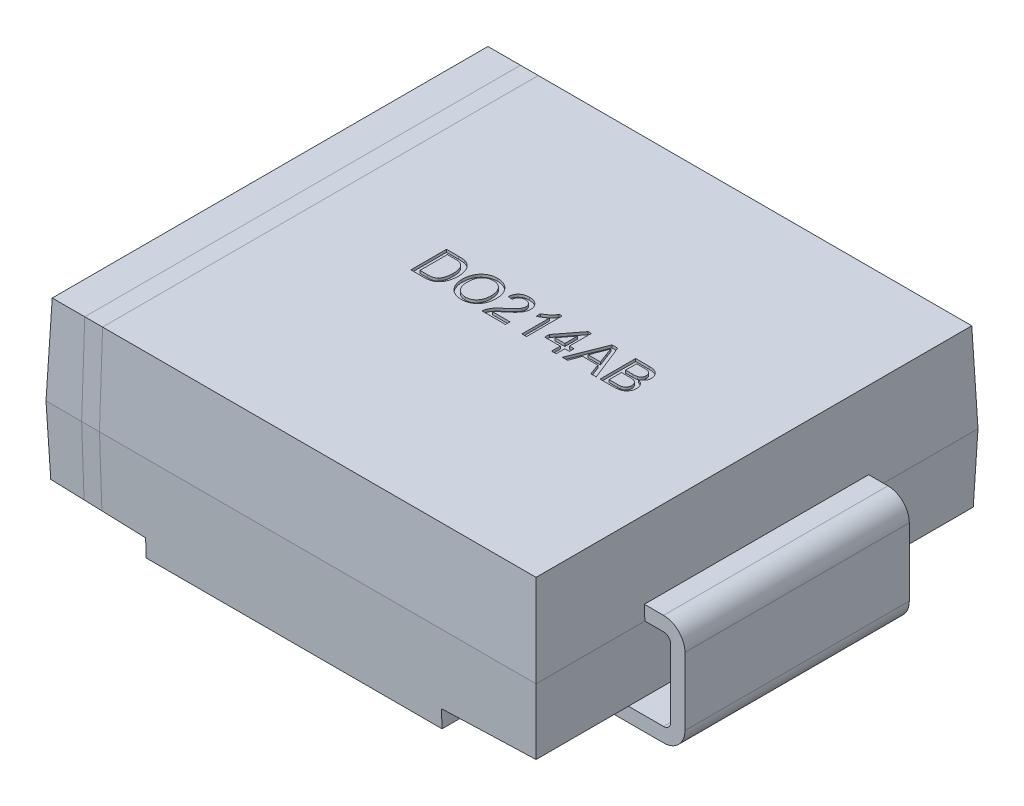
from build123d import *

# Parameters (mm, degrees)
SKETCH1_W                      = 6.985
SKETCH1_H                      = 6.2992
EXTRUDE1_DEPTH                 = 1.27
EXTRUDE1_TAPER                 = 2
EXTRUDE1_OTHER_WAY_DEPTH       = 1.27
EXTRUDE1_OTHER_WAY_TAPER       = 2
CUT_EXTRUDE1_REACH             = 6.871
CUT_EXTRUDE1_DIRECTION_2_REACH = 6.871
EXTRUDE2_DEPTH                 = 1.59893
CUT_EXTRUDE2_DEPTH             = 0.0381


with BuildPart() as part:
    # Sketch1 → Extrude1 (new body)
    with BuildSketch(Plane(origin=(0, 0, 0), x_dir=(1, 0, 0), z_dir=(0, 1, 0))):
        Rectangle(SKETCH1_W, SKETCH1_H)
    extrude(amount=EXTRUDE1_DEPTH, taper=EXTRUDE1_TAPER)

    # Sketch1 → Extrude1 other way (add)
    with BuildSketch(Plane(origin=(0, 0, 0), x_dir=(1, 0, 0), z_dir=(0, 1, 0))):
        Rectangle(SKETCH1_W, SKETCH1_H)
    extrude(amount=-EXTRUDE1_OTHER_WAY_DEPTH, taper=EXTRUDE1_OTHER_WAY_TAPER)

    # Cut-Extrude1: up to this plane
    cut_extrude1_end = Plane(origin=(-3.4925, 0, 3.1496), z_dir=(0, -0.03489949670250105, 0.9993908270190958))
    # Sketch2 → Cut-Extrude1 (cut, up to the surface)
    with BuildSketch(Plane.XY, mode=Mode.PRIVATE) as cut_extrude1_sk1:
        Polygon((2.1082, -1.016), (2.1082, -1.27), (3.448150623, -1.27), (3.458667339, -0.968840641), align=None)
    cut_extrude1_tool1 = split(extrude(cut_extrude1_sk1.sketch, amount=CUT_EXTRUDE1_REACH, mode=Mode.PRIVATE), bisect_by=cut_extrude1_end, keep=Keep.BOTH, mode=Mode.PRIVATE)
    add(cut_extrude1_tool1.solids().sort_by_distance((2.799785, -1.130712, 0))[0], mode=Mode.SUBTRACT)
    # Sketch2 → Cut-Extrude1 (cut, up to the surface)
    with BuildSketch(Plane.XY, mode=Mode.PRIVATE) as cut_extrude1_sk2:
        Polygon((-2.1082, -1.016), (-2.1082, -1.27), (-3.448150623, -1.27), (-3.458667339, -0.968840641), align=None)
    cut_extrude1_tool2 = split(extrude(cut_extrude1_sk2.sketch, amount=CUT_EXTRUDE1_REACH, mode=Mode.PRIVATE), bisect_by=cut_extrude1_end, keep=Keep.BOTH, mode=Mode.PRIVATE)
    add(cut_extrude1_tool2.solids().sort_by_distance((-2.799785, -1.130712, 0))[0], mode=Mode.SUBTRACT)

    # Cut-Extrude1 direction 2: up to this plane
    cut_extrude1_direction_2_end = Plane(origin=(-3.4925, 0, -3.1496), z_dir=(0, -0.034899496702501046, -0.9993908270190958))
    # Sketch2 → Cut-Extrude1 direction 2 (cut, up to the surface)
    with BuildSketch(Plane.XY, mode=Mode.PRIVATE) as cut_extrude1_direction_2_sk1:
        Polygon((2.1082, -1.016), (2.1082, -1.27), (3.448150623, -1.27), (3.458667339, -0.968840641), align=None)
    cut_extrude1_direction_2_tool1 = split(extrude(cut_extrude1_direction_2_sk1.sketch, amount=-CUT_EXTRUDE1_DIRECTION_2_REACH, mode=Mode.PRIVATE), bisect_by=cut_extrude1_direction_2_end, keep=Keep.BOTH, mode=Mode.PRIVATE)
    add(cut_extrude1_direction_2_tool1.solids().sort_by_distance((2.799785, -1.130712, 0))[0], mode=Mode.SUBTRACT)
    # Sketch2 → Cut-Extrude1 direction 2 (cut, up to the surface)
    with BuildSketch(Plane.XY, mode=Mode.PRIVATE) as cut_extrude1_direction_2_sk2:
        Polygon((-2.1082, -1.016), (-2.1082, -1.27), (-3.448150623, -1.27), (-3.458667339, -0.968840641), align=None)
    cut_extrude1_direction_2_tool2 = split(extrude(cut_extrude1_direction_2_sk2.sketch, amount=-CUT_EXTRUDE1_DIRECTION_2_REACH, mode=Mode.PRIVATE), bisect_by=cut_extrude1_direction_2_end, keep=Keep.BOTH, mode=Mode.PRIVATE)
    add(cut_extrude1_direction_2_tool2.solids().sort_by_distance((-2.799785, -1.130712, 0))[0], mode=Mode.SUBTRACT)

    # Sketch3 → Extrude2 (add, symmetric)
    with BuildSketch(Plane.XY):
        with BuildLine():
            Line((3.4854041, 0.2032), (3.7592, 0.2032))
            ThreePointArc((3.7592, 0.2032), (3.974726147, 0.113926147), (4.064, -0.1016))
            Line((4.064, -0.1016), (4.064, -1.0668))
            ThreePointArc((4.064, -1.0668), (3.974726147, -1.282326147), (3.7592, -1.3716))
            Line((3.7592, -1.3716), (2.5781, -1.3716))
            Line((2.5781, -1.3716), (2.5781, -1.1684))
            Line((2.5781, -1.1684), (3.7592, -1.1684))
            ThreePointArc((3.7592, -1.1684), (3.831042049, -1.138642049), (3.8608, -1.0668))
            Line((3.8608, -1.0668), (3.8608, -0.1016))
            ThreePointArc((3.8608, -0.1016), (3.831042049, -0.029757951), (3.7592, 0))
            Line((3.7592, 0), (3.4925, 0))
            Line((3.4925, 0), (3.4854041, 0.2032))
        make_face()
        with BuildLine():
            Line((-3.4854041, 0.2032), (-3.4925, 0))
            Line((-3.4925, 0), (-3.7592, 0))
            ThreePointArc((-3.7592, 0), (-3.831042049, -0.029757951), (-3.8608, -0.1016))
            Line((-3.8608, -0.1016), (-3.8608, -1.0668))
            ThreePointArc((-3.8608, -1.0668), (-3.831042049, -1.138642049), (-3.7592, -1.1684))
            Line((-3.7592, -1.1684), (-2.5781, -1.1684))
            Line((-2.5781, -1.1684), (-2.5781, -1.3716))
            Line((-2.5781, -1.3716), (-3.7592, -1.3716))
            ThreePointArc((-3.7592, -1.3716), (-3.974726147, -1.282326147), (-4.064, -1.0668))
            Line((-4.064, -1.0668), (-4.064, -0.1016))
            ThreePointArc((-4.064, -0.1016), (-3.974726147, 0.113926147), (-3.7592, 0.2032))
            Line((-3.7592, 0.2032), (-3.4854041, 0.2032))
        make_face()
    extrude(amount=EXTRUDE2_DEPTH, both=True)

    # Sketch5 → Cut-Extrude2 (cut)
    # profile 1 of 7: a face of its own
    with BuildSketch(Plane(origin=(0, 1.27, 0), x_dir=(1, 0, 0), z_dir=(0, 1, 0))):
        with BuildLine():
            Line((-1.239701999, -0.201883132), (-1.239701999, 0.306116868))
            Line((-1.239701999, 0.306116868), (-1.065992864, 0.306116868))
            add(Edge.make_bspline(
                [(-1.065992864, 0.306116868), (-1.061243888, 0.306095414), (-1.052016264, 0.306053727), (-1.038612202, 0.305788039), (-1.026061099, 0.305147202), (-1.014420787, 0.304366578), (-1.003632561, 0.303327244), (-0.993710201, 0.30216501), (-0.984645968, 0.300649027), (-0.978947184, 0.299388963), (-0.976238057, 0.298789945)],
                knots=[0, 0, 0, 0, 1.263127796, 2.454354013, 3.565393221, 4.605443485, 5.557051711, 6.447822442, 7.26211484, 8, 8, 8, 8], degree=3))
            add(Edge.make_bspline(
                [(-0.976238057, 0.298789945), (-0.969231785, 0.296951768), (-0.95546728, 0.293340489), (-0.936037234, 0.285217384), (-0.918199605, 0.275028432), (-0.907620769, 0.266635663), (-0.902358249, 0.262460618)],
                knots=[0, 0, 0, 0, 1.04477941, 2.052571232, 3.03123721, 4, 4, 4, 4], degree=3))
            add(Edge.make_bspline(
                [(-0.902358249, 0.262460618), (-0.89909078, 0.25959125), (-0.892541052, 0.253839526), (-0.88354504, 0.24436314), (-0.875199588, 0.234310235), (-0.86725543, 0.22385388), (-0.860220668, 0.212612863), (-0.853626566, 0.200910731), (-0.847874912, 0.188512489), (-0.842580601, 0.175620761), (-0.837863731, 0.162185298), (-0.833988043, 0.148214777), (-0.83042752, 0.133855083), (-0.827779317, 0.11894925), (-0.825467573, 0.103623709), (-0.824000015, 0.087790743), (-0.823047815, 0.071497617), (-0.822937469, 0.060462837), (-0.822881486, 0.054864464)],
                knots=[0, 0, 0, 0, 0.908997367, 1.822109427, 2.728529095, 3.640759027, 4.565643067, 5.499218265, 6.448003669, 7.421473682, 8.413047621, 9.423472075, 10.452328391, 11.505545429, 12.587978234, 13.692612971, 14.829372988, 16, 16, 16, 16], degree=3))
            add(Edge.make_bspline(
                [(-0.822881486, 0.054864464), (-0.823017946, 0.045495698), (-0.823283494, 0.027264299), (-0.825909664, 0.000747068), (-0.829973439, -0.024178261), (-0.835887689, -0.047362018), (-0.843171704, -0.06867562), (-0.851117933, -0.088293138), (-0.860264607, -0.105876545), (-0.870298303, -0.121574478), (-0.881049143, -0.135486258), (-0.892311923, -0.147820678), (-0.904120032, -0.158583197), (-0.916413485, -0.168056265), (-0.929830751, -0.175900226), (-0.944231069, -0.182943442), (-0.960081634, -0.188602663), (-0.977083949, -0.193552909), (-0.995437713, -0.197261514), (-1.01504354, -0.199986716), (-1.035978483, -0.20163468), (-1.050352268, -0.20179871), (-1.057750076, -0.201883132)],
                knots=[0, 0, 0, 0, 1.410753827, 2.745293735, 4.009435601, 5.211453015, 6.344066657, 7.400119332, 8.396481539, 9.324811333, 10.202671465, 11.041621015, 11.837259285, 12.606727868, 13.374311266, 14.17412185, 15.017911533, 15.905707008, 16.839601966, 17.835295848, 18.885883805, 20, 20, 20, 20], degree=3))
            Line((-1.057750076, -0.201883132), (-1.239701999, -0.201883132))
        make_face()
        with BuildLine():
            Line((-1.168060973, -0.143267747), (-1.063347031, -0.143267747))
            add(Edge.make_bspline(
                [(-1.063347031, -0.143267747), (-1.055711551, -0.143153447), (-1.041266923, -0.142937217), (-1.020887835, -0.141276575), (-1.003101588, -0.138412191), (-0.987710951, -0.134336945), (-0.974357171, -0.129067027), (-0.962599102, -0.122836724), (-0.952140153, -0.115766731), (-0.946248626, -0.110110441), (-0.943368665, -0.107345472)],
                knots=[0, 0, 0, 0, 1.423649224, 2.693227144, 3.808972214, 4.778671344, 5.656058397, 6.479437267, 7.256702014, 8, 8, 8, 8], degree=3))
            add(Edge.make_bspline(
                [(-0.943368665, -0.107345472), (-0.939620972, -0.103060267), (-0.93192192, -0.094256983), (-0.922334603, -0.078878113), (-0.913973997, -0.06157394), (-0.906985005, -0.04216025), (-0.901254212, -0.020702708), (-0.897431992, 0.002990885), (-0.894932992, 0.028759424), (-0.894662746, 0.04668306), (-0.894522512, 0.055983855)],
                knots=[0, 0, 0, 0, 0.782184731, 1.606876467, 2.483531085, 3.422528604, 4.441347086, 5.534669947, 6.720709839, 8, 8, 8, 8], degree=3))
            add(Edge.make_bspline(
                [(-0.894522512, 0.055983855), (-0.8946094, 0.062463826), (-0.894778307, 0.075060626), (-0.895831299, 0.093412052), (-0.89791006, 0.11058715), (-0.900568601, 0.126615628), (-0.904198421, 0.141446535), (-0.908349183, 0.155221969), (-0.913570985, 0.16776185), (-0.9195297, 0.179162987), (-0.92606648, 0.189501095), (-0.93287804, 0.19899823), (-0.939999237, 0.207623254), (-0.947580964, 0.215253449), (-0.955395306, 0.222114456), (-0.963587943, 0.228065808), (-0.972135949, 0.233105676), (-0.978142578, 0.23572191), (-0.981122672, 0.237019913)],
                knots=[0, 0, 0, 0, 1.460126857, 2.838427476, 4.139102445, 5.35666337, 6.496721546, 7.577303074, 8.594995104, 9.55219858, 10.472533725, 11.348579167, 12.184287935, 12.989560785, 13.769667798, 14.524891986, 15.268148459, 16, 16, 16, 16], degree=3))
            add(Edge.make_bspline(
                [(-0.981122672, 0.237019913), (-0.983451199, 0.237872053), (-0.988385196, 0.239677682), (-0.996437956, 0.241721383), (-1.005424918, 0.243602154), (-1.015434664, 0.24492221), (-1.026416568, 0.24620516), (-1.038438894, 0.246984783), (-1.051438591, 0.247338087), (-1.060429648, 0.247445805), (-1.065076999, 0.247501483)],
                knots=[0, 0, 0, 0, 0.699400087, 1.48198292, 2.341906832, 3.289648813, 4.329964754, 5.462247508, 6.688271602, 8, 8, 8, 8], degree=3))
            Line((-1.065076999, 0.247501483), (-1.168060973, 0.247501483))
            Line((-1.168060973, 0.247501483), (-1.168060973, -0.143267747))
        make_face(mode=Mode.SUBTRACT)
    # profile 2 of 7: a face of its own
    with BuildSketch(Plane(origin=(0, 1.27, 0), x_dir=(1, 0, 0), z_dir=(0, 1, 0))):
        with BuildLine():
            add(Edge.make_bspline(
                [(-0.757753281, 0.045400522), (-0.75757672, 0.055585484), (-0.757232699, 0.075430366), (-0.754018329, 0.104327072), (-0.748799016, 0.131515092), (-0.741337548, 0.156992308), (-0.731880115, 0.180798644), (-0.720382798, 0.202988005), (-0.706499766, 0.223309223), (-0.69079452, 0.241955744), (-0.673252481, 0.258440635), (-0.654575195, 0.27308158), (-0.634529442, 0.285293859), (-0.613300429, 0.295377175), (-0.590797963, 0.303118853), (-0.567085224, 0.308538733), (-0.542187573, 0.312035082), (-0.525169446, 0.312428607), (-0.516473633, 0.312629689)],
                knots=[0, 0, 0, 0, 1.203621547, 2.345195544, 3.432004029, 4.472479546, 5.478447225, 6.455936844, 7.420185704, 8.381829745, 9.332027588, 10.260832629, 11.182364398, 12.100723901, 13.034044877, 13.989196293, 14.972532542, 16, 16, 16, 16], degree=3))
            add(Edge.make_bspline(
                [(-0.516473633, 0.312629689), (-0.510738148, 0.312529536), (-0.49934851, 0.312330652), (-0.482509948, 0.310817406), (-0.466104077, 0.308116525), (-0.450147054, 0.304497041), (-0.434595443, 0.299748436), (-0.419439958, 0.294142853), (-0.404813267, 0.287196745), (-0.390618063, 0.279419886), (-0.37702191, 0.270721134), (-0.36424428, 0.261111639), (-0.352315779, 0.250664079), (-0.341076174, 0.239550183), (-0.330900516, 0.227394872), (-0.321368422, 0.214568418), (-0.312753803, 0.200843388), (-0.305026092, 0.186332234), (-0.298116732, 0.171259078), (-0.292211351, 0.155561449), (-0.287140507, 0.139427651), (-0.282895784, 0.122762188), (-0.27985008, 0.105570759), (-0.277424753, 0.087927438), (-0.276148236, 0.069774563), (-0.275920087, 0.057511973), (-0.275804563, 0.051302765)],
                knots=[0, 0, 0, 0, 1.034375294, 2.054082248, 3.045783978, 4.031219655, 5.002789406, 5.976610191, 6.94273282, 7.920236376, 8.894345378, 9.851183672, 10.800797181, 11.752517031, 12.698794154, 13.65688337, 14.632873302, 15.61821402, 16.620222298, 17.621258913, 18.640965868, 19.669244166, 20.720417492, 21.788124603, 22.880008887, 24, 24, 24, 24], degree=3))
            add(Edge.make_bspline(
                [(-0.275804563, 0.051302765), (-0.275910408, 0.044991168), (-0.276119524, 0.03252152), (-0.277534486, 0.014100034), (-0.280022481, -0.003792609), (-0.283322383, -0.021209763), (-0.287744151, -0.038115167), (-0.292998743, -0.054557291), (-0.299354469, -0.070438203), (-0.306532555, -0.085796178), (-0.314654557, -0.100419991), (-0.323613676, -0.114207386), (-0.333416259, -0.127029392), (-0.343913407, -0.139043303), (-0.355350255, -0.150034288), (-0.367585974, -0.160105119), (-0.380573518, -0.169350778), (-0.394356518, -0.177520861), (-0.40868762, -0.184682231), (-0.423283234, -0.191035657), (-0.438154202, -0.196454111), (-0.453351348, -0.200845229), (-0.468833215, -0.204163474), (-0.484556237, -0.206648211), (-0.500571955, -0.208078932), (-0.511348839, -0.208289736), (-0.516778922, -0.208395953)],
                knots=[0, 0, 0, 0, 1.141429366, 2.255090526, 3.338676798, 4.407031443, 5.458968682, 6.496860253, 7.526652771, 8.550250826, 9.560787671, 10.54935636, 11.521089193, 12.477323897, 13.431786008, 14.386110112, 15.340986122, 16.312041, 17.28047646, 18.236612773, 19.189437236, 20.140779471, 21.09494583, 22.051062463, 23.018000708, 24, 24, 24, 24], degree=3))
            add(Edge.make_bspline(
                [(-0.516778922, -0.208395953), (-0.522617467, -0.208309571), (-0.534182162, -0.208138469), (-0.551275094, -0.206430589), (-0.56794278, -0.203825157), (-0.584136765, -0.200063701), (-0.59983492, -0.195156616), (-0.615055821, -0.189217236), (-0.629852999, -0.182324938), (-0.644042848, -0.174282374), (-0.65757707, -0.165339907), (-0.670324487, -0.15554199), (-0.682278049, -0.144978919), (-0.693245952, -0.1334761), (-0.703583412, -0.121450514), (-0.712877089, -0.108455178), (-0.721430501, -0.094784811), (-0.728990539, -0.080307639), (-0.735819902, -0.065453866), (-0.741573788, -0.050218743), (-0.746630338, -0.034826795), (-0.750657369, -0.019183151), (-0.753866422, -0.003323898), (-0.756024278, 0.012724574), (-0.757582698, 0.028986168), (-0.757696134, 0.039901536), (-0.757753281, 0.045400522)],
                knots=[0, 0, 0, 0, 1.072727997, 2.12480551, 3.153819198, 4.171534612, 5.177148798, 6.173931848, 7.17235114, 8.174500385, 9.168706755, 10.151274001, 11.127173509, 12.097141049, 13.070188938, 14.039134204, 15.03036519, 16.031505612, 17.038625933, 18.033164522, 19.022845559, 20.014762458, 21.000193215, 21.994692725, 22.989758729, 24, 24, 24, 24], degree=3))
        make_face()
        with BuildLine():
            add(Edge.make_bspline(
                [(-0.686112255, 0.044586419), (-0.686002469, 0.037252328), (-0.685788393, 0.022951366), (-0.683339249, 0.002101325), (-0.679623064, -0.01757175), (-0.674500696, -0.036123087), (-0.667614978, -0.053369216), (-0.659382211, -0.069475854), (-0.649525196, -0.084335935), (-0.638261407, -0.097907889), (-0.62587253, -0.110099915), (-0.612633758, -0.120749002), (-0.598542115, -0.129666858), (-0.583753832, -0.137030453), (-0.56816269, -0.14277841), (-0.551815387, -0.14681448), (-0.53469991, -0.149338715), (-0.523029266, -0.149631449), (-0.51708421, -0.149780568)],
                knots=[0, 0, 0, 0, 1.215430442, 2.370003584, 3.475209778, 4.53279855, 5.55522989, 6.548792651, 7.526809858, 8.505409025, 9.467826767, 10.404123909, 11.316848639, 12.227335424, 13.138360512, 14.065900994, 15.014765094, 16, 16, 16, 16], degree=3))
            add(Edge.make_bspline(
                [(-0.51708421, -0.149780568), (-0.511038386, -0.149629243), (-0.499200678, -0.149332949), (-0.481827163, -0.14685278), (-0.465320378, -0.142630397), (-0.449516712, -0.13700945), (-0.434701881, -0.129410887), (-0.420529407, -0.120513011), (-0.407385635, -0.109640062), (-0.394947921, -0.097426472), (-0.383792129, -0.083543485), (-0.373893713, -0.068333082), (-0.365852936, -0.051567145), (-0.35891081, -0.033615006), (-0.353827386, -0.014137362), (-0.350070424, 0.006644365), (-0.347806399, 0.028797024), (-0.347567985, 0.044004413), (-0.347445589, 0.05181158)],
                knots=[0, 0, 0, 0, 0.976878588, 1.912725521, 2.8289017, 3.727303729, 4.617335839, 5.514666588, 6.426584173, 7.368641557, 8.327632997, 9.299405846, 10.294892156, 11.327373912, 12.405931897, 13.542618837, 14.738430195, 16, 16, 16, 16], degree=3))
            add(Edge.make_bspline(
                [(-0.347445589, 0.05181158), (-0.347488844, 0.056834202), (-0.347573694, 0.06668677), (-0.348697399, 0.081209568), (-0.350146835, 0.095280623), (-0.352353624, 0.10888178), (-0.355394858, 0.121956712), (-0.35876403, 0.13460496), (-0.362977061, 0.146717528), (-0.367757332, 0.158341916), (-0.373106374, 0.169418447), (-0.379139382, 0.179853742), (-0.385786241, 0.18960723), (-0.392867609, 0.198863829), (-0.400775613, 0.207265268), (-0.409129479, 0.21516643), (-0.418118964, 0.222404075), (-0.427654355, 0.228980092), (-0.437600382, 0.234899544), (-0.447936541, 0.239965827), (-0.458498161, 0.24441592), (-0.46946203, 0.247827104), (-0.480676757, 0.250578273), (-0.492187678, 0.252668042), (-0.50403752, 0.253750222), (-0.512028101, 0.253925644), (-0.516066582, 0.254014304)],
                knots=[0, 0, 0, 0, 1.220438779, 2.394059227, 3.538503547, 4.658058814, 5.74010225, 6.800155734, 7.837851593, 8.854470756, 9.853724944, 10.825214244, 11.781044712, 12.72106398, 13.654479919, 14.581868691, 15.514082315, 16.456304431, 17.39516604, 18.324312202, 19.252140633, 20.177768678, 21.111585046, 22.057694709, 23.018348693, 24, 24, 24, 24], degree=3))
            add(Edge.make_bspline(
                [(-0.516066582, 0.254014304), (-0.521774425, 0.253900948), (-0.533036635, 0.253677285), (-0.549615948, 0.251190923), (-0.565600204, 0.247475959), (-0.581014207, 0.242282241), (-0.595726126, 0.235404941), (-0.60981218, 0.226970875), (-0.623397404, 0.217209688), (-0.636267579, 0.205883551), (-0.648265397, 0.192872584), (-0.658408349, 0.177533053), (-0.666957105, 0.160231145), (-0.67409516, 0.141010715), (-0.679537716, 0.119722914), (-0.683299203, 0.096459355), (-0.685674129, 0.071195522), (-0.68596248, 0.053682874), (-0.686112255, 0.044586419)],
                knots=[0, 0, 0, 0, 0.895090134, 1.766112571, 2.624765742, 3.468151641, 4.313618154, 5.168136083, 6.041303099, 6.935189387, 7.854749729, 8.809996334, 9.809869957, 10.877771942, 12.021723904, 13.25217762, 14.572720513, 16, 16, 16, 16], degree=3))
        make_face(mode=Mode.SUBTRACT)
    # profile 3 of 7: a face of its own
    with BuildSketch(Plane(origin=(0, 1.27, 0), x_dir=(1, 0, 0), z_dir=(0, 1, 0))):
        with BuildLine():
            Line((0.108451847, -0.136754927), (0.108451847, -0.201883132))
            Line((0.108451847, -0.201883132), (-0.223701999, -0.201883132))
            add(Edge.make_bspline(
                [(-0.223701999, -0.201883132), (-0.223708799, -0.19801238), (-0.223722376, -0.190283849), (-0.222414584, -0.178853842), (-0.22036632, -0.167575464), (-0.218050349, -0.160343089), (-0.21688389, -0.15670044)],
                knots=[0, 0, 0, 0, 1.01057331, 2.01775941, 3.001627217, 4, 4, 4, 4], degree=3))
            add(Edge.make_bspline(
                [(-0.21688389, -0.15670044), (-0.214728661, -0.150748786), (-0.210340261, -0.138630238), (-0.201449316, -0.121144867), (-0.190991464, -0.103765243), (-0.180809273, -0.089615776), (-0.171484585, -0.07831134), (-0.163664619, -0.069466928), (-0.154998662, -0.06041363), (-0.145493656, -0.051153099), (-0.13524108, -0.04162536), (-0.124226944, -0.031798637), (-0.112321189, -0.021856062), (-0.104009726, -0.01526571), (-0.099754883, -0.011891946)],
                knots=[0, 0, 0, 0, 1.204657718, 2.452881516, 3.728232997, 5.065887527, 5.768225529, 6.518857853, 7.313994055, 8.154655305, 9.046094665, 9.979688118, 10.965752482, 12, 12, 12, 12], degree=3))
            add(Edge.make_bspline(
                [(-0.099754883, -0.011891946), (-0.093218394, -0.006390289), (-0.080631968, 0.004203501), (-0.062857963, 0.019923704), (-0.046624302, 0.034520803), (-0.032189488, 0.048250642), (-0.01943546, 0.06098005), (-0.008332271, 0.072680187), (0.001215614, 0.083314539), (0.009091635, 0.093268026), (0.015736875, 0.102666886), (0.02136813, 0.111834894), (0.026061033, 0.120932194), (0.029969593, 0.12993), (0.033060933, 0.138866791), (0.03516812, 0.147768604), (0.036597142, 0.156547111), (0.036740117, 0.162388427), (0.036810822, 0.165277124)],
                knots=[0, 0, 0, 0, 1.782554561, 3.432421876, 4.950675607, 6.337395053, 7.588547463, 8.709982106, 9.702713005, 10.569305638, 11.356701089, 12.103210377, 12.812277205, 13.490692607, 14.148717897, 14.782152033, 15.397739362, 16, 16, 16, 16], degree=3))
            add(Edge.make_bspline(
                [(0.036810822, 0.165277124), (0.036740108, 0.168132117), (0.036601372, 0.173733459), (0.035285049, 0.181930986), (0.033452622, 0.189825402), (0.030490145, 0.197274587), (0.026963906, 0.204499143), (0.022440653, 0.211270782), (0.017208179, 0.21775827), (0.01121744, 0.223790564), (0.004674149, 0.229449818), (-0.002637045, 0.234154034), (-0.010235947, 0.238389229), (-0.018384711, 0.241794569), (-0.027070097, 0.244295171), (-0.036228878, 0.246109964), (-0.045859602, 0.24726064), (-0.052431894, 0.247419985), (-0.055793345, 0.247501483)],
                knots=[0, 0, 0, 0, 0.988194508, 1.938783882, 2.870742509, 3.789494954, 4.709148727, 5.651055405, 6.603531303, 7.592354411, 8.592907906, 9.593461401, 10.59787167, 11.603930315, 12.645063138, 13.723588815, 14.835711238, 16, 16, 16, 16], degree=3))
            add(Edge.make_bspline(
                [(-0.055793345, 0.247501483), (-0.059324456, 0.247420389), (-0.066235101, 0.24726168), (-0.076336612, 0.246106415), (-0.085926246, 0.244341326), (-0.094981114, 0.241642656), (-0.103490194, 0.238242995), (-0.111418832, 0.233963727), (-0.118893997, 0.229133207), (-0.125680269, 0.223414235), (-0.131817005, 0.217073063), (-0.137264998, 0.210169444), (-0.14172881, 0.202570154), (-0.14541521, 0.194442283), (-0.148379384, 0.185760281), (-0.150531273, 0.176457775), (-0.151704498, 0.166561626), (-0.151940423, 0.159784746), (-0.152060973, 0.156321996)],
                knots=[0, 0, 0, 0, 1.131143733, 2.213731411, 3.253917892, 4.251203413, 5.236093891, 6.184197493, 7.13373276, 8.082770301, 9.020476205, 9.957489029, 10.893177274, 11.836722509, 12.812818608, 13.827831385, 14.890097571, 16, 16, 16, 16], degree=3))
            Line((-0.152060973, 0.156321996), (-0.217189178, 0.162834817))
            add(Edge.make_bspline(
                [(-0.217189178, 0.162834817), (-0.216522824, 0.168510899), (-0.21522649, 0.179553228), (-0.211997497, 0.195546182), (-0.207464284, 0.210424214), (-0.202039913, 0.224394754), (-0.195239951, 0.237219983), (-0.18755318, 0.249165174), (-0.178486989, 0.259851478), (-0.168471252, 0.269615741), (-0.157396238, 0.278220626), (-0.145365978, 0.285738187), (-0.132385975, 0.292026164), (-0.118528524, 0.297232346), (-0.103761811, 0.301182407), (-0.088106727, 0.304014974), (-0.071538095, 0.305761), (-0.060173468, 0.305996553), (-0.054368665, 0.306116868)],
                knots=[0, 0, 0, 0, 1.130804643, 2.199883102, 3.223565206, 4.205909148, 5.160801384, 6.091796021, 7.01151579, 7.927798993, 8.855738875, 9.7815393, 10.730299821, 11.705391175, 12.706931101, 13.751121791, 14.851322166, 16, 16, 16, 16], degree=3))
            add(Edge.make_bspline(
                [(-0.054368665, 0.306116868), (-0.048494382, 0.306016278), (-0.037051244, 0.305820327), (-0.020376753, 0.303815357), (-0.004643909, 0.300692635), (0.010204963, 0.296340516), (0.024082133, 0.290633591), (0.036998278, 0.283661017), (0.04901295, 0.27549081), (0.059925409, 0.266024892), (0.069765459, 0.255691256), (0.078388811, 0.244663039), (0.085598349, 0.232987353), (0.091736823, 0.220823347), (0.096289955, 0.207914002), (0.099491802, 0.194434824), (0.10166755, 0.180374295), (0.101847331, 0.170780763), (0.101939027, 0.165887701)],
                knots=[0, 0, 0, 0, 1.195390245, 2.328627238, 3.413424916, 4.457841177, 5.473507151, 6.462241215, 7.441013641, 8.425227782, 9.397253344, 10.342087291, 11.269524934, 12.186751184, 13.110685745, 14.048630397, 15.004728144, 16, 16, 16, 16], degree=3))
            add(Edge.make_bspline(
                [(0.101939027, 0.165887701), (0.10179901, 0.160860635), (0.101518666, 0.150795408), (0.099330547, 0.135750862), (0.09558665, 0.120869583), (0.090623243, 0.105970457), (0.083842195, 0.090994349), (0.075275493, 0.075734664), (0.064647563, 0.060135034), (0.054426474, 0.046873616), (0.044912299, 0.035757203), (0.036478882, 0.026607746), (0.026721906, 0.016887059), (0.016007393, 0.006258494), (0.003898353, -0.004900721), (-0.009257293, -0.016924754), (-0.023747529, -0.029497178), (-0.033806577, -0.038086055), (-0.03900248, -0.042522555)],
                knots=[0, 0, 0, 0, 0.927118007, 1.856282007, 2.79721255, 3.754929441, 4.749232485, 5.824981375, 6.979078785, 8.228161913, 8.911614355, 9.677694854, 10.522803217, 11.452009355, 12.461436787, 13.560019032, 14.739651695, 16, 16, 16, 16], degree=3))
            add(Edge.make_bspline(
                [(-0.03900248, -0.042522555), (-0.043451985, -0.046144927), (-0.051936508, -0.053052233), (-0.064007386, -0.06306594), (-0.07481922, -0.072248237), (-0.084624845, -0.080299617), (-0.093067146, -0.087609513), (-0.100443491, -0.093857785), (-0.106485894, -0.099358594), (-0.115687403, -0.107714433), (-0.127341899, -0.119624836), (-0.135929431, -0.131197843), (-0.14005296, -0.136754927)],
                knots=[0, 0, 0, 0, 1.241996727, 2.368296581, 3.394949853, 4.3125351, 5.114548721, 5.812230366, 6.404953749, 6.883082049, 8.503329734, 10, 10, 10, 10], degree=3))
            Line((-0.14005296, -0.136754927), (0.108451847, -0.136754927))
        make_face()
    # profile 4 of 7: a face of its own
    with BuildSketch(Plane(origin=(0, 1.27, 0), x_dir=(1, 0, 0), z_dir=(0, 1, 0))):
        with BuildLine():
            Line((0.408041591, -0.201883132), (0.342913386, -0.201883132))
            Line((0.342913386, -0.201883132), (0.342913386, 0.19397424))
            add(Edge.make_bspline(
                [(0.342913386, 0.19397424), (0.339163298, 0.190357741), (0.331369151, 0.182841246), (0.31819397, 0.172203528), (0.303488784, 0.16142175), (0.287444549, 0.151053865), (0.271090166, 0.141293619), (0.25528576, 0.132515779), (0.240295193, 0.125087596), (0.230420826, 0.121025837), (0.225682617, 0.119076804)],
                knots=[0, 0, 0, 0, 0.893362401, 1.856755847, 2.901947673, 4.020460078, 5.132200827, 6.168787962, 7.121294059, 8, 8, 8, 8], degree=3))
            Line((0.225682617, 0.119076804), (0.225682617, 0.179116868))
            add(Edge.make_bspline(
                [(0.225682617, 0.179116868), (0.23382098, 0.183308142), (0.249861213, 0.191568894), (0.272522594, 0.205836348), (0.29367943, 0.221302856), (0.312981493, 0.237964993), (0.330284562, 0.254996688), (0.34486611, 0.272182337), (0.357067022, 0.288891989), (0.36318845, 0.300545118), (0.366115309, 0.306116868)],
                knots=[0, 0, 0, 0, 1.141258006, 2.249351951, 3.335817539, 4.406819942, 5.426913362, 6.360259544, 7.215985427, 8, 8, 8, 8], degree=3))
            Line((0.366115309, 0.306116868), (0.408041591, 0.306116868))
            Line((0.408041591, 0.306116868), (0.408041591, -0.201883132))
        make_face()
    # profile 5 of 7: a face of its own
    with BuildSketch(Plane(origin=(0, 1.27, 0), x_dir=(1, 0, 0), z_dir=(0, 1, 0))):
        Polygon((0.766246719, -0.201883132), (0.766246719, -0.078139542), (0.544810822, -0.078139542), (0.544810822, -0.013011337), (0.785785181, 0.299604047), (0.831374924, 0.299604047), (0.831374924, -0.013011337), (0.896503129, -0.013011337), (0.896503129, -0.078139542), (0.831374924, -0.078139542), (0.831374924, -0.201883132), align=None)
        Polygon((0.766246719, -0.013011337), (0.766246719, 0.169958214), (0.62520345, -0.013011337), align=None, mode=Mode.SUBTRACT)
    # profile 6 of 7: a face of its own
    with BuildSketch(Plane(origin=(0, 1.27, 0), x_dir=(1, 0, 0), z_dir=(0, 1, 0))):
        Polygon((0.91817861, -0.201883132), (1.11987252, 0.306116868), (1.2006722, 0.306116868), (1.40236611, -0.201883132), (1.326349283, -0.201883132), (1.268548001, -0.04557544), (1.051996719, -0.04557544), (0.994195437, -0.201883132), align=None)
        with BuildLine():
            Line((1.073570437, 0.013039945), (1.246974283, 0.013039945))
            Line((1.246974283, 0.013039945), (1.197619315, 0.146552765))
            add(Edge.make_bspline(
                [(1.197619315, 0.146552765), (1.195727222, 0.151711519), (1.192027822, 0.161797856), (1.186510903, 0.176452452), (1.181470735, 0.190369058), (1.176528435, 0.20334813), (1.172066934, 0.215578201), (1.167954653, 0.226976664), (1.163887642, 0.237464293), (1.161446972, 0.244240381), (1.16027236, 0.247501483)],
                knots=[0, 0, 0, 0, 1.225184869, 2.395467751, 3.491410812, 4.525364584, 5.492066482, 6.394148129, 7.227157926, 8, 8, 8, 8], degree=3))
            add(Edge.make_bspline(
                [(1.16027236, 0.247501483), (1.158329325, 0.239459893), (1.154435244, 0.223343555), (1.146281986, 0.199730958), (1.136954941, 0.176334308), (1.12938027, 0.161257667), (1.125571238, 0.153676163)],
                knots=[0, 0, 0, 0, 0.9891762, 1.982431084, 2.985436691, 4, 4, 4, 4], degree=3))
            Line((1.125571238, 0.153676163), (1.073570437, 0.013039945))
        make_face(mode=Mode.SUBTRACT)
    # profile 7 of 7: a face of its own
    with BuildSketch(Plane(origin=(0, 1.27, 0), x_dir=(1, 0, 0), z_dir=(0, 1, 0))):
        with BuildLine():
            Line((1.456605693, -0.201883132), (1.456605693, 0.306116868))
            Line((1.456605693, 0.306116868), (1.646800405, 0.306116868))
            add(Edge.make_bspline(
                [(1.646800405, 0.306116868), (1.651516919, 0.306098774), (1.660720179, 0.306063468), (1.674158842, 0.305180504), (1.68688626, 0.303972791), (1.698929831, 0.302416013), (1.710237443, 0.300157159), (1.720798558, 0.297420708), (1.730668138, 0.294264301), (1.742732194, 0.28945607), (1.756634697, 0.282055181), (1.771525598, 0.271011886), (1.78448126, 0.257752851), (1.795141865, 0.242550616), (1.803925054, 0.226311763), (1.810152232, 0.209345655), (1.814133604, 0.192021688), (1.814585338, 0.180291128), (1.814810822, 0.174435778)],
                knots=[0, 0, 0, 0, 0.939712594, 1.833646414, 2.682508961, 3.487467313, 4.25240329, 4.978730417, 5.660668875, 6.315918528, 7.564895217, 8.787077865, 9.996481721, 11.241996224, 12.475862915, 13.665015424, 14.834484263, 16, 16, 16, 16], degree=3))
            add(Edge.make_bspline(
                [(1.814810822, 0.174435778), (1.81457379, 0.168988169), (1.814102012, 0.158145471), (1.810347189, 0.142173518), (1.804420929, 0.12666485), (1.79604103, 0.111808007), (1.785330469, 0.097874792), (1.772052431, 0.085336625), (1.756397721, 0.074166635), (1.744648862, 0.068212702), (1.738590469, 0.065142509)],
                knots=[0, 0, 0, 0, 0.926741525, 1.844548388, 2.778836836, 3.746021974, 4.738420572, 5.759761325, 6.844803049, 8, 8, 8, 8], degree=3))
            add(Edge.make_bspline(
                [(1.738590469, 0.065142509), (1.742338231, 0.063969299), (1.749675712, 0.061672353), (1.760224102, 0.057469264), (1.770125819, 0.052683445), (1.779402416, 0.047307033), (1.787991212, 0.041290239), (1.795867973, 0.034623682), (1.803087313, 0.027410528), (1.809636333, 0.019655162), (1.815388961, 0.011407492), (1.820548349, 0.002847781), (1.824808747, -0.006127051), (1.828300841, -0.015493701), (1.831025193, -0.025194293), (1.832981574, -0.035266136), (1.834096661, -0.045685786), (1.834264144, -0.052764067), (1.834349283, -0.056362299)],
                knots=[0, 0, 0, 0, 1.127427615, 2.20731145, 3.257257018, 4.283066884, 5.282973838, 6.264540225, 7.242620376, 8.210460609, 9.17525685, 10.12748095, 11.077310519, 12.023587065, 12.994999128, 13.967387486, 14.966724908, 16, 16, 16, 16], degree=3))
            add(Edge.make_bspline(
                [(1.834349283, -0.056362299), (1.834173798, -0.06213921), (1.833825964, -0.07358975), (1.831032474, -0.09044302), (1.826311622, -0.106654445), (1.819813772, -0.121961906), (1.812071322, -0.136115908), (1.803271757, -0.148745852), (1.793639482, -0.159721777), (1.782903265, -0.168954492), (1.771132357, -0.176790365), (1.757994298, -0.183388683), (1.74359067, -0.189207767), (1.727628727, -0.193856266), (1.710115735, -0.197549027), (1.690814026, -0.199948221), (1.669693946, -0.201665721), (1.654979328, -0.201808636), (1.647309219, -0.201883132)],
                knots=[0, 0, 0, 0, 1.028073207, 2.037766189, 3.031549473, 4.027532207, 4.992436545, 5.898794514, 6.762903869, 7.584966804, 8.412380356, 9.273953678, 10.198004568, 11.174406109, 12.229717296, 13.381036288, 14.634844708, 16, 16, 16, 16], degree=3))
            Line((1.647309219, -0.201883132), (1.456605693, -0.201883132))
        make_face()
        with BuildLine():
            Line((1.528246719, 0.091193791), (1.632960661, 0.091193791))
            add(Edge.make_bspline(
                [(1.632960661, 0.091193791), (1.636387162, 0.091207348), (1.642970245, 0.091233393), (1.652466184, 0.09159654), (1.661230481, 0.091906357), (1.669229234, 0.092683972), (1.676502069, 0.093445612), (1.683019882, 0.094470899), (1.688814597, 0.095626164), (1.692362702, 0.096697759), (1.694018354, 0.097197797)],
                knots=[0, 0, 0, 0, 1.335841395, 2.566453063, 3.705076039, 4.753984432, 5.69893722, 6.555639608, 7.326018133, 8, 8, 8, 8], degree=3))
            add(Edge.make_bspline(
                [(1.694018354, 0.097197797), (1.697908543, 0.098560531), (1.705408012, 0.101187596), (1.715458004, 0.107153924), (1.724017675, 0.114313489), (1.731064088, 0.122792711), (1.736478908, 0.132546213), (1.74049384, 0.14337173), (1.742692105, 0.155420594), (1.743006237, 0.163776057), (1.743169796, 0.168126483)],
                knots=[0, 0, 0, 0, 1.059015028, 2.041559358, 2.989777133, 3.920090524, 4.862499371, 5.848878527, 6.879979022, 8, 8, 8, 8], degree=3))
            add(Edge.make_bspline(
                [(1.743169796, 0.168126483), (1.743038284, 0.172307524), (1.742781981, 0.18045589), (1.740630552, 0.192288731), (1.736907582, 0.203297016), (1.731865662, 0.213478331), (1.725481251, 0.222536074), (1.717861234, 0.230323612), (1.708732992, 0.236210648), (1.700200819, 0.239882993), (1.692526806, 0.242180391), (1.685670345, 0.243539667), (1.677893074, 0.244737325), (1.669169398, 0.245755533), (1.659496019, 0.246545757), (1.648843131, 0.247173537), (1.637236093, 0.247440077), (1.629195499, 0.247480505), (1.625023161, 0.247501483)],
                knots=[0, 0, 0, 0, 1.216168307, 2.37017178, 3.484610845, 4.588286376, 5.664695412, 6.69777344, 7.738183022, 8.803673002, 9.390844981, 10.0665252, 10.835811589, 11.680682236, 12.621801058, 13.660007223, 14.785756265, 16, 16, 16, 16], degree=3))
            Line((1.625023161, 0.247501483), (1.528246719, 0.247501483))
            Line((1.528246719, 0.247501483), (1.528246719, 0.091193791))
        make_face(mode=Mode.SUBTRACT)
        with BuildLine():
            Line((1.528246719, -0.143267747), (1.64842861, -0.143267747))
            add(Edge.make_bspline(
                [(1.64842861, -0.143267747), (1.653211572, -0.143212798), (1.661999193, -0.143111841), (1.674018941, -0.142795133), (1.683734614, -0.142021533), (1.689408054, -0.141188564), (1.691881335, -0.14082544)],
                knots=[0, 0, 0, 0, 1.317581857, 2.420761387, 3.311546315, 4, 4, 4, 4], degree=3))
            add(Edge.make_bspline(
                [(1.691881335, -0.14082544), (1.695427285, -0.140080117), (1.702293161, -0.138636979), (1.7119724, -0.135416047), (1.720847038, -0.131726296), (1.728762182, -0.127037034), (1.736091415, -0.12163298), (1.742461065, -0.114883059), (1.748327814, -0.107214005), (1.753410836, -0.098437645), (1.757521197, -0.088728652), (1.760662676, -0.078237038), (1.762336057, -0.066999588), (1.76258244, -0.059284469), (1.762708258, -0.05534467)],
                knots=[0, 0, 0, 0, 1.067651492, 2.067249321, 3.003744366, 3.895862395, 4.774133402, 5.679610569, 6.621910665, 7.616993802, 8.661192143, 9.724711987, 10.838102842, 12, 12, 12, 12], degree=3))
            add(Edge.make_bspline(
                [(1.762708258, -0.05534467), (1.762568083, -0.050719111), (1.762294728, -0.041698799), (1.759696394, -0.02866399), (1.755404373, -0.016574043), (1.749362457, -0.005596391), (1.741951731, 0.004277062), (1.732985502, 0.012652443), (1.722530812, 0.019298722), (1.710555531, 0.024514765), (1.696558826, 0.02822589), (1.680154277, 0.030743663), (1.661079486, 0.032368322), (1.647448673, 0.032505379), (1.640185822, 0.032578406)],
                knots=[0, 0, 0, 0, 0.96167883, 1.875371887, 2.752872588, 3.621584364, 4.472914353, 5.312011319, 6.159851575, 7.038572308, 8.019870099, 9.164119506, 10.488969081, 12, 12, 12, 12], degree=3))
            Line((1.640185822, 0.032578406), (1.528246719, 0.032578406))
            Line((1.528246719, 0.032578406), (1.528246719, -0.143267747))
        make_face(mode=Mode.SUBTRACT)
    extrude(amount=-CUT_EXTRUDE2_DEPTH, mode=Mode.SUBTRACT)


solid = part.part
